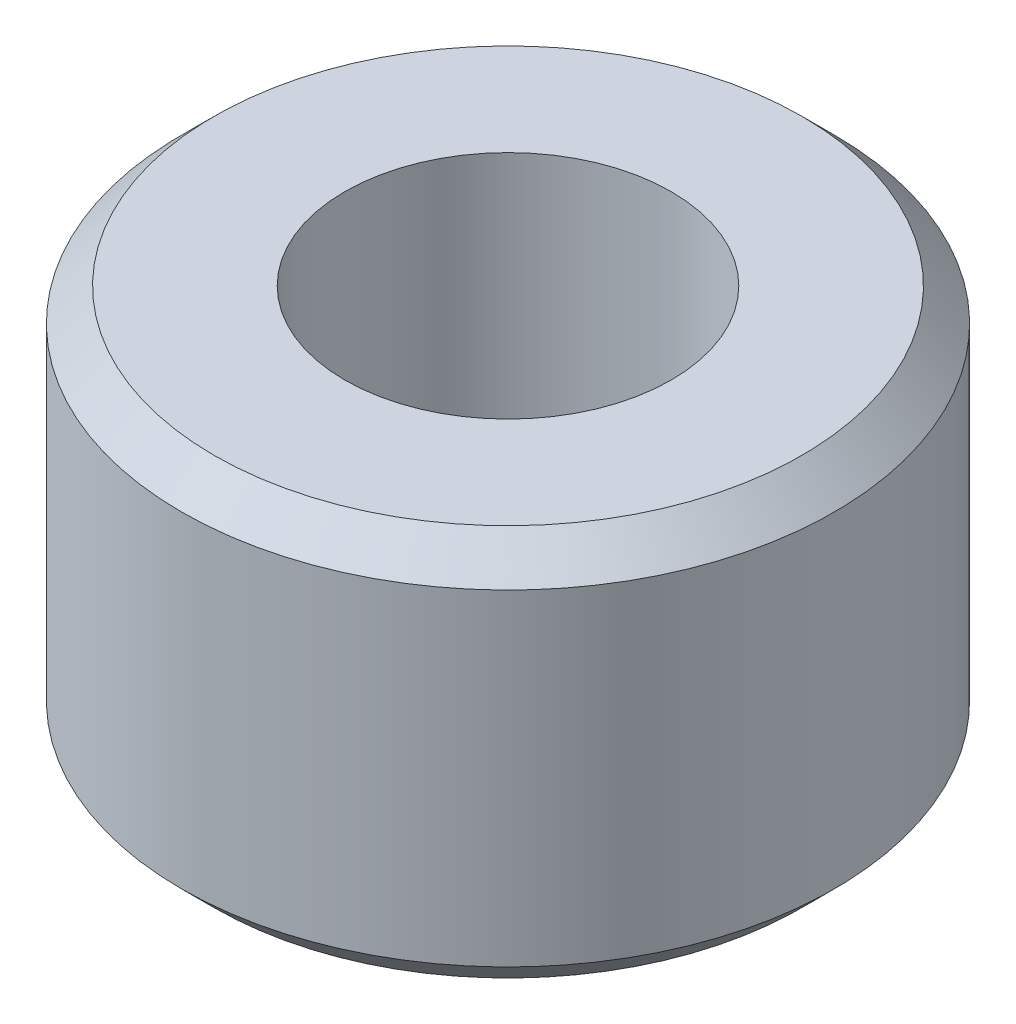
from build123d import *

# Parameters (mm, degrees)
SKETCH1_R           = 6.35
SKETCH1_R_2         = 3.175
BOSS_EXTRUDE1_DEPTH = 7.62
CHAMFER1_SIZE       = 0.635


with BuildPart() as part:
    # Sketch1 → Boss-Extrude1 (new body)
    with BuildSketch(Plane(origin=(0, 0, 0), x_dir=(1, 0, 0), z_dir=(0, 1, 0))):
        with Locations(Location((0, 0, 0), (0, 0, 90))):
            Circle(SKETCH1_R)
        with Locations(Location((0, 0, 0), (0, 0, 90))):
            Circle(SKETCH1_R_2, mode=Mode.SUBTRACT)
    extrude(amount=BOSS_EXTRUDE1_DEPTH)

    # Chamfer1
    chamfer1_edges = [part.edges().sort_by_distance(p)[0] for p in [
        (0, 0, 6.35),
        (0, 7.62, 6.35),
    ]]
    chamfer(chamfer1_edges, length=CHAMFER1_SIZE)


solid = part.part
